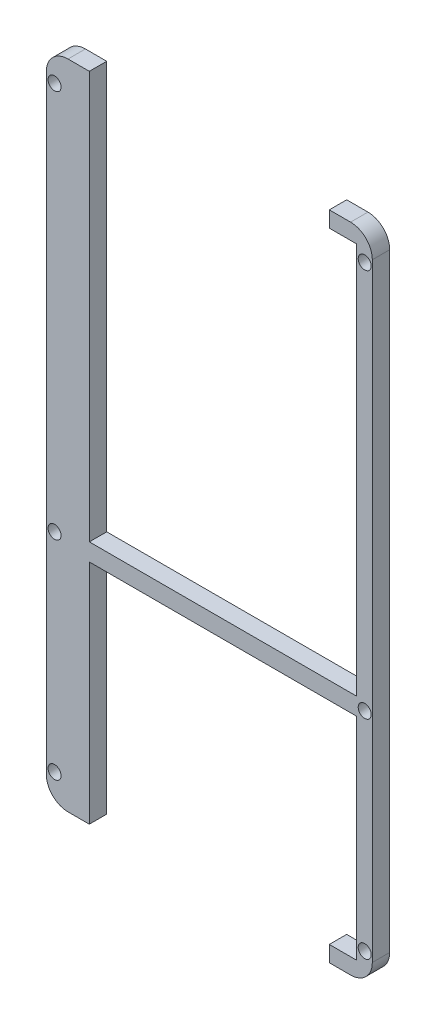
from build123d import *

# Parameters (mm, degrees)
LID_DEPTH             = 8
SKETCH2_R             = 3
INSETSCREWHOLES_DEPTH = 5
SKETCH3_R             = 1.75
SCREWHOLES_DEPTH      = 444.138052318
FILLET2_R             = 10
CHAMFER1_SIZE         = 2


with BuildPart() as part:
    # Sketch1 → Lid (new body)
    with BuildSketch(Plane.XY):
        Polygon((-65.612006704, -435), (-65.612006704, -135), (-45.812006704, -135), (-45.812006704, -322.5), (77.087993296, -322.5), (77.087993296, -154.8), (77.087993296, -142.3), (64.587993296, -142.3), (64.587993296, -135), (84.387993296, -135), (84.387993296, -435), (64.587993296, -435), (64.587993296, -427.7), (77.087993296, -427.7), (77.087993296, -330.5), (-45.812006704, -330.5), (-45.812006704, -435), align=None)
    extrude(amount=LID_DEPTH)

    # Sketch2 → InsetScrewHoles (cut)
    with BuildSketch(Plane.XY.offset(8)):
        with Locations((80.887993296, -147.8)):
            Circle(SKETCH2_R)
        with Locations((-61.812006704, -147.8)):
            Circle(SKETCH2_R)
        with Locations((-61.812006704, -326.5)):
            Circle(SKETCH2_R)
        with Locations((80.887993296, -326.5)):
            Circle(SKETCH2_R)
        with Locations((80.887993296, -422.2)):
            Circle(SKETCH2_R)
        with Locations((-61.812006704, -422.2)):
            Circle(SKETCH2_R)
    extrude(amount=-INSETSCREWHOLES_DEPTH, mode=Mode.SUBTRACT)

    # Sketch3 → ScrewHoles (cut, through all)
    with BuildSketch(Plane.XY.offset(3)):
        with Locations((-61.812006704, -147.8)):
            Circle(SKETCH3_R)
        with Locations((80.887993296, -147.8)):
            Circle(SKETCH3_R)
        with Locations((80.887993296, -326.5)):
            Circle(SKETCH3_R)
        with Locations((-61.812006704, -326.5)):
            Circle(SKETCH3_R)
        with Locations((80.887993296, -422.2)):
            Circle(SKETCH3_R)
        with Locations((-61.812006704, -422.2)):
            Circle(SKETCH3_R)
    extrude(amount=-SCREWHOLES_DEPTH, mode=Mode.SUBTRACT)

    # Fillet2
    fillet2_edges = [part.edges().sort_by_distance(p)[0] for p in [
        (-65.612006704, -435, 4),
        (-65.612006704, -135, 4),
        (84.387993296, -135, 4),
        (84.387993296, -435, 4),
    ]]
    fillet(fillet2_edges, radius=FILLET2_R)

    # Chamfer1
    chamfer1_edges = [part.edges().sort_by_distance(p)[0] for p in [
        (77.087993296, -232.4, 0),
    ]]
    chamfer(chamfer1_edges, length=CHAMFER1_SIZE)


solid = part.part
